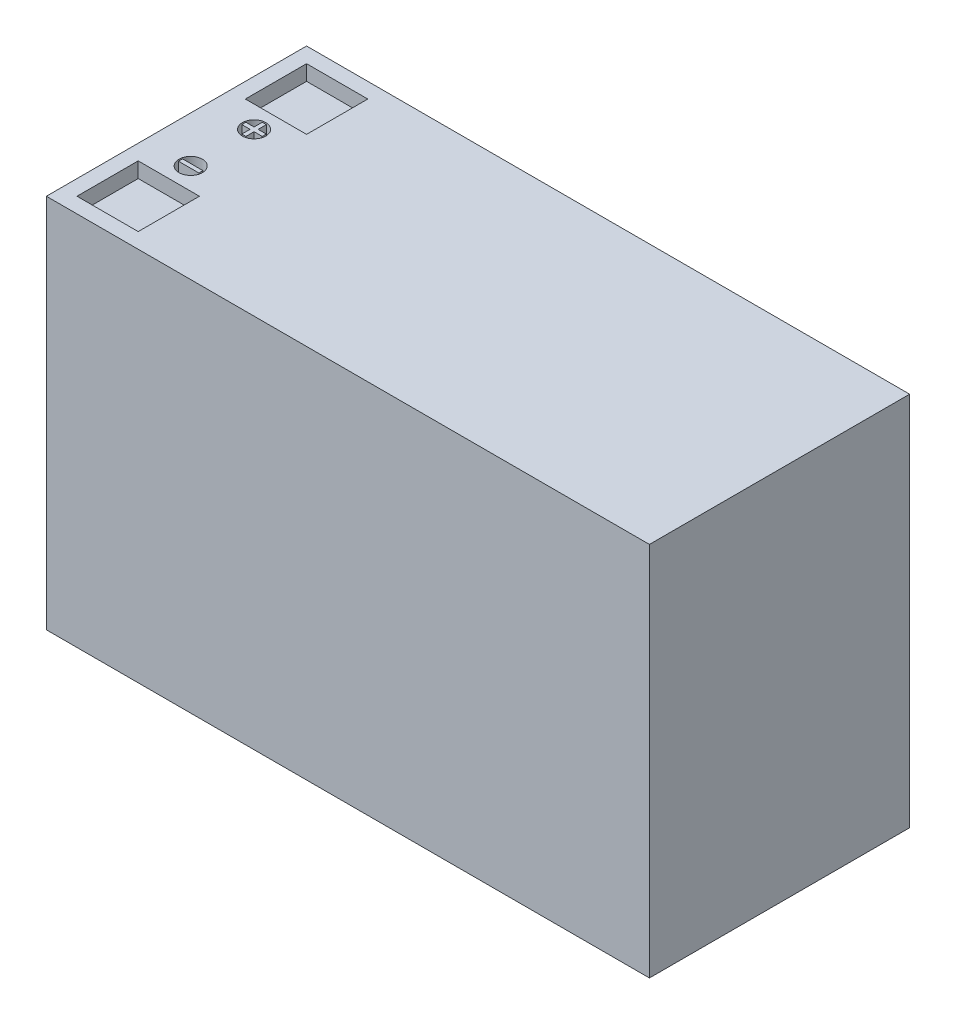
from build123d import *

# Parameters (mm, degrees)
SKETCH1_W           = 150.114
SKETCH1_H           = 64.77
BOSS_EXTRUDE1_DEPTH = 93.472
SKETCH2_R           = 2.91386686
SKETCH2_W           = 15.24
SKETCH2_H           = 15.24
CUT_EXTRUDE1_DEPTH  = 3.81


with BuildPart() as part:
    # Sketch1 → Boss-Extrude1 (new body)
    with BuildSketch(Plane(origin=(0, 0, 0), x_dir=(1, 0, 0), z_dir=(0, 1, 0))):
        with Locations((3.604380952, 5.860142857)):
            Rectangle(SKETCH1_W, SKETCH1_H)
    extrude(amount=BOSS_EXTRUDE1_DEPTH)

    # Sketch2 → Cut-Extrude1 (cut)
    # profile 1 of 4: a face of its own
    with BuildSketch(Plane(origin=(0, 93.472, 0), x_dir=(1, 0, 0), z_dir=(0, 1, 0))):
        with Locations(Location((-60.022619048, -2.026557143, 0), (0, 0, 270))):
            Circle(SKETCH2_R)
        Polygon((-60.022619048, -1.518557143), (-57.482619048, -1.518557143), (-57.482619048, -2.534557143), (-62.562619048, -2.534557143), (-62.562619048, -1.518557143), align=None, mode=Mode.SUBTRACT)
    # profile 2 of 4: a face of its own
    with BuildSketch(Plane(origin=(0, 93.472, 0), x_dir=(1, 0, 0), z_dir=(0, 1, 0))):
        with Locations(Location((-60.022619048, 13.746842857, 0), (0, 0, 270))):
            Circle(SKETCH2_R)
        Polygon((-57.482619048, 13.238842857), (-57.482619048, 14.254842857), (-59.515974161, 14.254842857), (-59.515974161, 16.286842857), (-60.531974161, 16.286842857), (-60.531974161, 14.254842857), (-62.562619048, 14.254842857), (-62.562619048, 13.238842857), (-60.531974161, 13.238842857), (-60.531974161, 11.206842857), (-59.515974161, 11.206842857), (-59.515974161, 13.238842857), align=None, mode=Mode.SUBTRACT)
    # profile 3 of 4: a face of its own
    with BuildSketch(Plane(origin=(0, 93.472, 0), x_dir=(1, 0, 0), z_dir=(0, 1, 0))):
        with Locations((-60.022619048, -15.094857143)):
            Rectangle(SKETCH2_W, SKETCH2_H)
    # profile 4 of 4: a face of its own
    with BuildSketch(Plane(origin=(0, 93.472, 0), x_dir=(1, 0, 0), z_dir=(0, 1, 0))):
        with Locations((-60.022619048, 26.815142857)):
            Rectangle(SKETCH2_W, SKETCH2_H)
    extrude(amount=-CUT_EXTRUDE1_DEPTH, mode=Mode.SUBTRACT)


solid = part.part
